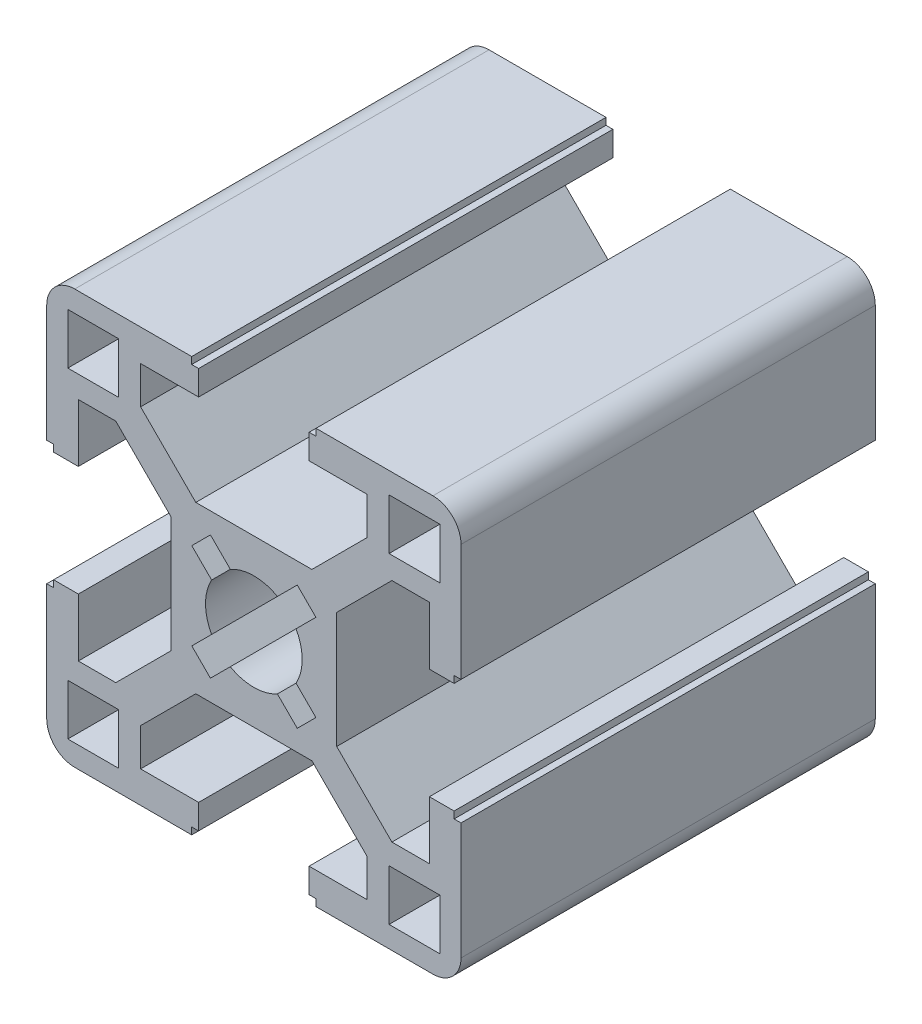
from build123d import *

# Parameters (mm, degrees)
SKETCH3_W           = 3.68
SKETCH3_H           = 3.68
BOSS_EXTRUDE1_DEPTH = 1219.2
SKETCH4_W           = 30
SKETCH4_H           = 2408.4
CUT_EXTRUDE1_DEPTH  = 1220.661280848


with BuildPart() as part:
    # Sketch3 → Boss-Extrude1 (new, symmetric)
    with BuildSketch(Plane.XY):
        with BuildLine():
            Line((-4.203948776, 6), (0, 6))
            Line((0, 6), (4.203948776, 6))
            Line((4.203948776, 6), (8.2, 9.996051224))
            Line((8.2, 9.996051224), (8.2, 12.71))
            Line((8.2, 12.71), (4, 12.71))
            Line((4, 12.71), (4, 14.5))
            Line((4, 14.5), (4.5, 14.5))
            Line((4.5, 14.5), (4.5, 15))
            Line((4.5, 15), (12.968, 15))
            ThreePointArc((12.968, 15), (14.404840979, 14.404840979), (15, 12.968))
            Line((15, 12.968), (15, 4.5))
            Line((15, 4.5), (14.5, 4.5))
            Line((14.5, 4.5), (14.5, 4))
            Line((14.5, 4), (12.71, 4))
            Line((12.71, 4), (12.71, 8.2))
            Line((12.71, 8.2), (9.996051224, 8.2))
            Line((9.996051224, 8.2), (6, 4.203948776))
            Line((6, 4.203948776), (6, 0))
            Line((6, 0), (6, -4.203948776))
            Line((6, -4.203948776), (9.996051224, -8.2))
            Line((9.996051224, -8.2), (12.71, -8.2))
            Line((12.71, -8.2), (12.71, -4))
            Line((12.71, -4), (14.5, -4))
            Line((14.5, -4), (14.5, -4.5))
            Line((14.5, -4.5), (15, -4.5))
            Line((15, -4.5), (15, -12.968))
            ThreePointArc((15, -12.968), (14.404840979, -14.404840979), (12.968, -15))
            Line((12.968, -15), (4.5, -15))
            Line((4.5, -15), (4.5, -14.5))
            Line((4.5, -14.5), (4, -14.5))
            Line((4, -14.5), (4, -12.71))
            Line((4, -12.71), (8.2, -12.71))
            Line((8.2, -12.71), (8.2, -9.996051224))
            Line((8.2, -9.996051224), (4.203948776, -6))
            Line((4.203948776, -6), (0, -6))
            Line((0, -6), (-4.203948776, -6))
            Line((-4.203948776, -6), (-8.2, -9.996051224))
            Line((-8.2, -9.996051224), (-8.2, -12.71))
            Line((-8.2, -12.71), (-4, -12.71))
            Line((-4, -12.71), (-4, -14.5))
            Line((-4, -14.5), (-4.5, -14.5))
            Line((-4.5, -14.5), (-4.5, -15))
            Line((-4.5, -15), (-12.968, -15))
            ThreePointArc((-12.968, -15), (-14.404840979, -14.404840979), (-15, -12.968))
            Line((-15, -12.968), (-15, -4.5))
            Line((-15, -4.5), (-14.5, -4.5))
            Line((-14.5, -4.5), (-14.5, -4))
            Line((-14.5, -4), (-12.71, -4))
            Line((-12.71, -4), (-12.71, -8.2))
            Line((-12.71, -8.2), (-9.996051224, -8.2))
            Line((-9.996051224, -8.2), (-6, -4.203948776))
            Line((-6, -4.203948776), (-6, 0))
            Line((-6, 0), (-6, 4.203948776))
            Line((-6, 4.203948776), (-9.996051224, 8.2))
            Line((-9.996051224, 8.2), (-12.71, 8.2))
            Line((-12.71, 8.2), (-12.71, 4))
            Line((-12.71, 4), (-14.5, 4))
            Line((-14.5, 4), (-14.5, 4.5))
            Line((-14.5, 4.5), (-15, 4.5))
            Line((-15, 4.5), (-15, 12.968))
            ThreePointArc((-15, 12.968), (-14.404840979, 14.404840979), (-12.968, 15))
            Line((-12.968, 15), (-4.5, 15))
            Line((-4.5, 15), (-4.5, 14.5))
            Line((-4.5, 14.5), (-4, 14.5))
            Line((-4, 14.5), (-4, 12.71))
            Line((-4, 12.71), (-8.2, 12.71))
            Line((-8.2, 12.71), (-8.2, 9.996051224))
            Line((-8.2, 9.996051224), (-4.203948776, 6))
        make_face()
        with Locations((-11.63, 11.63)):
            Rectangle(SKETCH3_W, SKETCH3_H, mode=Mode.SUBTRACT)
        with BuildLine():
            Line((-3.143089642, 4.493663594), (-1.705676589, 3.056250541))
            ThreePointArc((-1.705676589, 3.056250541), (0, 3.5), (1.705676589, 3.056250541))
            Line((1.705676589, 3.056250541), (3.143089642, 4.493663594))
            Line((3.143089642, 4.493663594), (4.493663594, 3.143089642))
            Line((4.493663594, 3.143089642), (3.056250541, 1.705676589))
            ThreePointArc((3.056250541, 1.705676589), (3.5, 0), (3.056250541, -1.705676589))
            Line((3.056250541, -1.705676589), (4.493663594, -3.143089642))
            Line((4.493663594, -3.143089642), (3.143089642, -4.493663594))
            Line((3.143089642, -4.493663594), (1.705676589, -3.056250541))
            ThreePointArc((1.705676589, -3.056250541), (0, -3.5), (-1.705676589, -3.056250541))
            Line((-1.705676589, -3.056250541), (-3.143089642, -4.493663594))
            Line((-3.143089642, -4.493663594), (-4.493663594, -3.143089642))
            Line((-4.493663594, -3.143089642), (-3.056250541, -1.705676589))
            ThreePointArc((-3.056250541, -1.705676589), (-3.5, 0), (-3.056250541, 1.705676589))
            Line((-3.056250541, 1.705676589), (-4.493663594, 3.143089642))
            Line((-4.493663594, 3.143089642), (-3.143089642, 4.493663594))
        make_face(mode=Mode.SUBTRACT)
        with Locations((11.63, 11.63)):
            Rectangle(SKETCH3_W, SKETCH3_H, mode=Mode.SUBTRACT)
        with Locations((11.63, -11.63)):
            Rectangle(SKETCH3_W, SKETCH3_H, mode=Mode.SUBTRACT)
        with Locations((-11.63, -11.63)):
            Rectangle(SKETCH3_W, SKETCH3_H, mode=Mode.SUBTRACT)
    extrude(amount=BOSS_EXTRUDE1_DEPTH, both=True)

    # Sketch4 → Cut-Extrude1 (cut, through all)
    with BuildSketch(Plane(origin=(0, 15, 0), x_dir=(1, 0, 0), z_dir=(0, 1, 0))):
        with Locations((0, 15)):
            Rectangle(SKETCH4_W, SKETCH4_H)
    extrude(amount=-CUT_EXTRUDE1_DEPTH, mode=Mode.SUBTRACT)


solid = part.part
